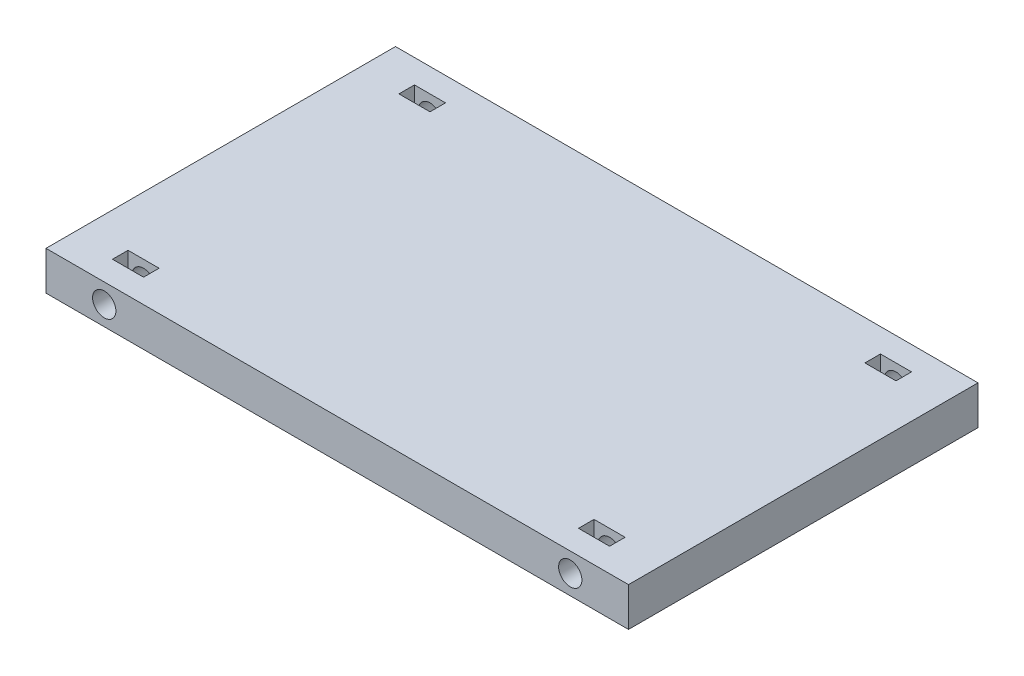
from build123d import *

# Parameters (mm, degrees)
SKETCH1_W           = 150
SKETCH1_H           = 90
SKETCH1_W_2         = 8
SKETCH1_H_2         = 4
BOSS_EXTRUDE1_DEPTH = 10
SKETCH3_R           = 3
CUT_EXTRUDE1_DEPTH  = 15
CUT_EXTRUDE2_START  = -15
SKETCH4_R           = 3
CUT_EXTRUDE2_DEPTH  = 15


with BuildPart() as part:
    # Sketch1 → Boss-Extrude1 (new body)
    with BuildSketch(Plane(origin=(0, 0, 0), x_dir=(1, 0, 0), z_dir=(0, 1, 0))):
        with Locations((75, 45)):
            Rectangle(SKETCH1_W, SKETCH1_H)
        with Locations((135, 8.120559305)):
            Rectangle(SKETCH1_W_2, SKETCH1_H_2, mode=Mode.SUBTRACT)
        with Locations((15, 81.879440695)):
            Rectangle(SKETCH1_W_2, SKETCH1_H_2, mode=Mode.SUBTRACT)
        with Locations((135, 81.879440695)):
            Rectangle(SKETCH1_W_2, SKETCH1_H_2, mode=Mode.SUBTRACT)
        with Locations((15, 8.120559305)):
            Rectangle(SKETCH1_W_2, SKETCH1_H_2, mode=Mode.SUBTRACT)
    extrude(amount=BOSS_EXTRUDE1_DEPTH)

    # Sketch3 → Cut-Extrude1 (cut)
    with BuildSketch(Plane.XY):
        with Locations((15, 5)):
            Circle(SKETCH3_R)
        with Locations((135, 5)):
            Circle(SKETCH3_R)
    extrude(amount=-CUT_EXTRUDE1_DEPTH, mode=Mode.SUBTRACT)

    # Sketch4 → Cut-Extrude2 (cut)
    with BuildSketch(Plane(origin=(0, 0, -90), x_dir=(-1, 0, 0), z_dir=(0, 0, -1)).offset(CUT_EXTRUDE2_START)):
        with Locations(Location((-15, 5, 0), (0, 0, 180))):
            Circle(SKETCH4_R)
        with Locations(Location((-135, 5, 0), (0, 0, 180))):
            Circle(SKETCH4_R)
    extrude(amount=CUT_EXTRUDE2_DEPTH, mode=Mode.SUBTRACT)


solid = part.part
